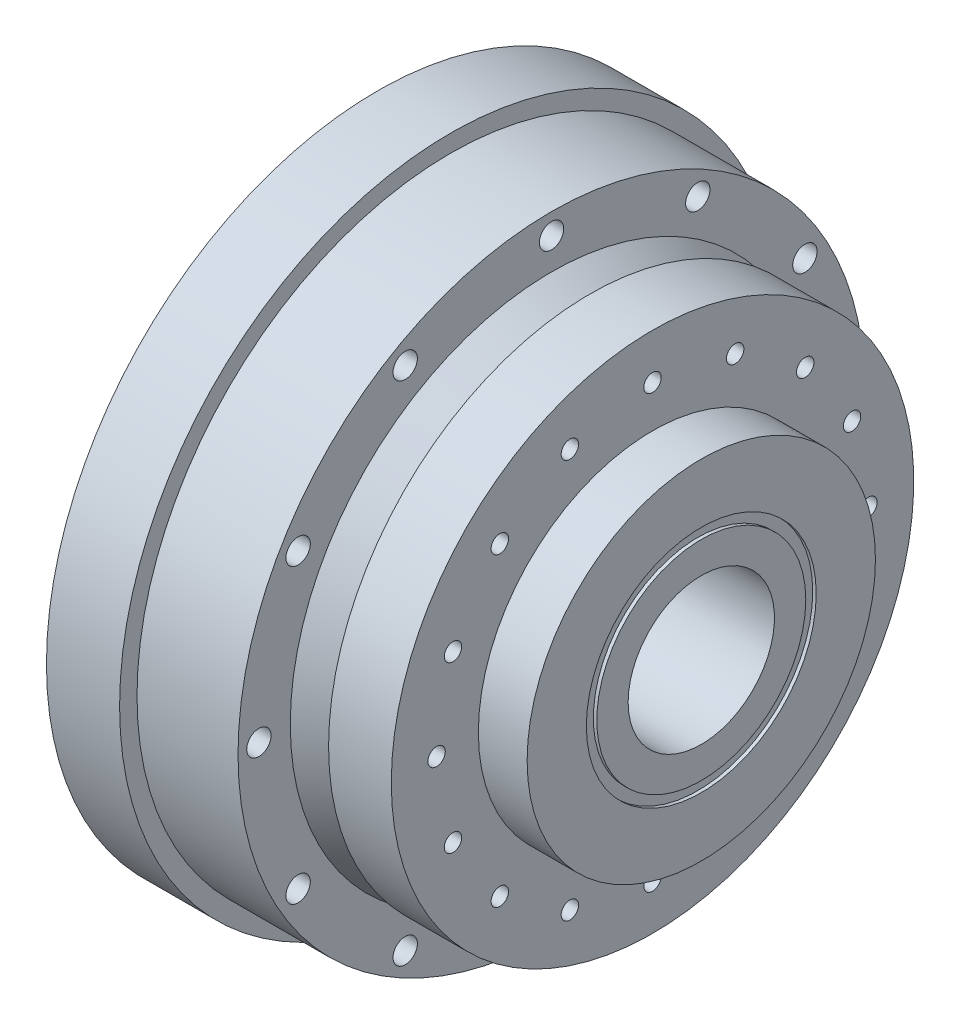
from build123d import *
from build123d.topology import SkipClean

# Parameters (mm, degrees)
CUT_EXTRUDE_1_REACH      = 83.699
SKETCH_5_R               = 1.75
PATTERN_CIRCULAR_2_COUNT = 12
PATTERN_CIRCULAR_5_COUNT = 16
PATTERN_CIRCULAR_6_COUNT = 6
CUT_EXTRUDE_START        = -0.5
SKETCH_19_R              = 16.5
SKETCH_19_R_2            = 15
CUT_EXTRUDE_6_DEPTH      = 0.5
SKETCH_20_R              = 16.5
SKETCH_20_R_2            = 15
CUT_EXTRUDE_7_DEPTH      = 0.5


with BuildPart() as part:
    # 草图1 → 旋转1 (revolve)
    with BuildSketch(Plane.XY):
        Polygon((0, 10.5), (0, 15), (5, 15), (5, 47.5), (15.5, 47.5), (15.5, 45), (30, 45), (30, 37.5), (35.5, 34.324573519), (35.5, 37.5), (44.5, 37.5), (44.5, 25), (51.5, 25), (51.5, 10.5), align=None)
    revolve(axis=Axis((-65.200779727, 0, 0), (1, 0, 0)))

    # 草图5 → 切除-拉伸1 (cut, up to next)
    with BuildSketch(Plane.ZY.offset(-5), mode=Mode.PRIVATE) as cut_extrude_1_sk1:
        with Locations((0, 42)):
            Circle(SKETCH_5_R)
    cut_extrude_1_tool1 = extrude(cut_extrude_1_sk1.sketch, amount=-CUT_EXTRUDE_1_REACH, mode=Mode.PRIVATE) & part.part
    cut_extrude_1 = cut_extrude_1_tool1.solids().sort_by_distance((5, 42, 0))[0]
    add(cut_extrude_1, mode=Mode.SUBTRACT)

    # 阵列(圆周)2: 切除-拉伸1 ×12 about axis
    pattern_circular_2_axis = Axis((51.5, 0, 0), (-1, 0, 0))
    for i in range(1, PATTERN_CIRCULAR_2_COUNT):
        add(cut_extrude_1.rotate(pattern_circular_2_axis, i * 360 / PATTERN_CIRCULAR_2_COUNT), mode=Mode.SUBTRACT)

    # 草图15 → M3 螺纹孔4 (revolve, cut)
    with BuildSketch(Plane(origin=(44.5, 31, 0), x_dir=(0, 0, -1), z_dir=(0, 1, 0))):
        Polygon((0, 0), (0, 14.251075774), (1.25, 13.5), (1.25, 0), align=None)
    hole_wizard_m3_4 = revolve(axis=Axis((50.85, 31, 0), (-1, 0, 0)), mode=Mode.SUBTRACT)

    # 阵列(圆周)5: M3 螺纹孔4 ×16 about axis
    pattern_circular_5_axis = Axis((51.5, 0, 0), (-1, 0, 0))
    for i in range(1, PATTERN_CIRCULAR_5_COUNT):
        add(hole_wizard_m3_4.rotate(pattern_circular_5_axis, i * 360 / PATTERN_CIRCULAR_5_COUNT), mode=Mode.SUBTRACT)

    # 草图17 → M3 螺纹孔5 (revolve, cut)
    with BuildSketch(Plane.ZX.offset(12.75)):
        Polygon((0, 0), (0, 8.251075774), (1.25, 7.5), (1.25, 0), align=None)
    hole_wizard_m3_5 = revolve(axis=Axis((-6.35, 12.75, 0), (1, 0, 0)), mode=Mode.SUBTRACT)

    # 阵列(圆周)6: M3 螺纹孔5 ×6 about axis
    pattern_circular_6_axis = Axis((51.5, 0, 0), (-1, 0, 0))
    for i in range(1, PATTERN_CIRCULAR_6_COUNT):
        add(hole_wizard_m3_5.rotate(pattern_circular_6_axis, i * 360 / PATTERN_CIRCULAR_6_COUNT), mode=Mode.SUBTRACT)

    # 草图19 → 切除-拉伸6 (cut)
    with SkipClean():  # the faces are left unmerged after this step: merging them gives an invalid solid
        with BuildSketch(Plane.ZY.offset(-5).offset(CUT_EXTRUDE_START)):
            Circle(SKETCH_19_R)
            Circle(SKETCH_19_R_2, mode=Mode.SUBTRACT)
        extrude(amount=CUT_EXTRUDE_6_DEPTH, mode=Mode.SUBTRACT)

    # 草图20 → 切除-拉伸7 (cut)
    with SkipClean():  # the faces are left unmerged after this step: merging them gives an invalid solid
        with BuildSketch(Plane(origin=(51.5, 0, 0), x_dir=(0, 0, -1), z_dir=(1, 0, 0))):
            Circle(SKETCH_20_R)
            Circle(SKETCH_20_R_2, mode=Mode.SUBTRACT)
        extrude(amount=-CUT_EXTRUDE_7_DEPTH, mode=Mode.SUBTRACT)


solid = part.part
